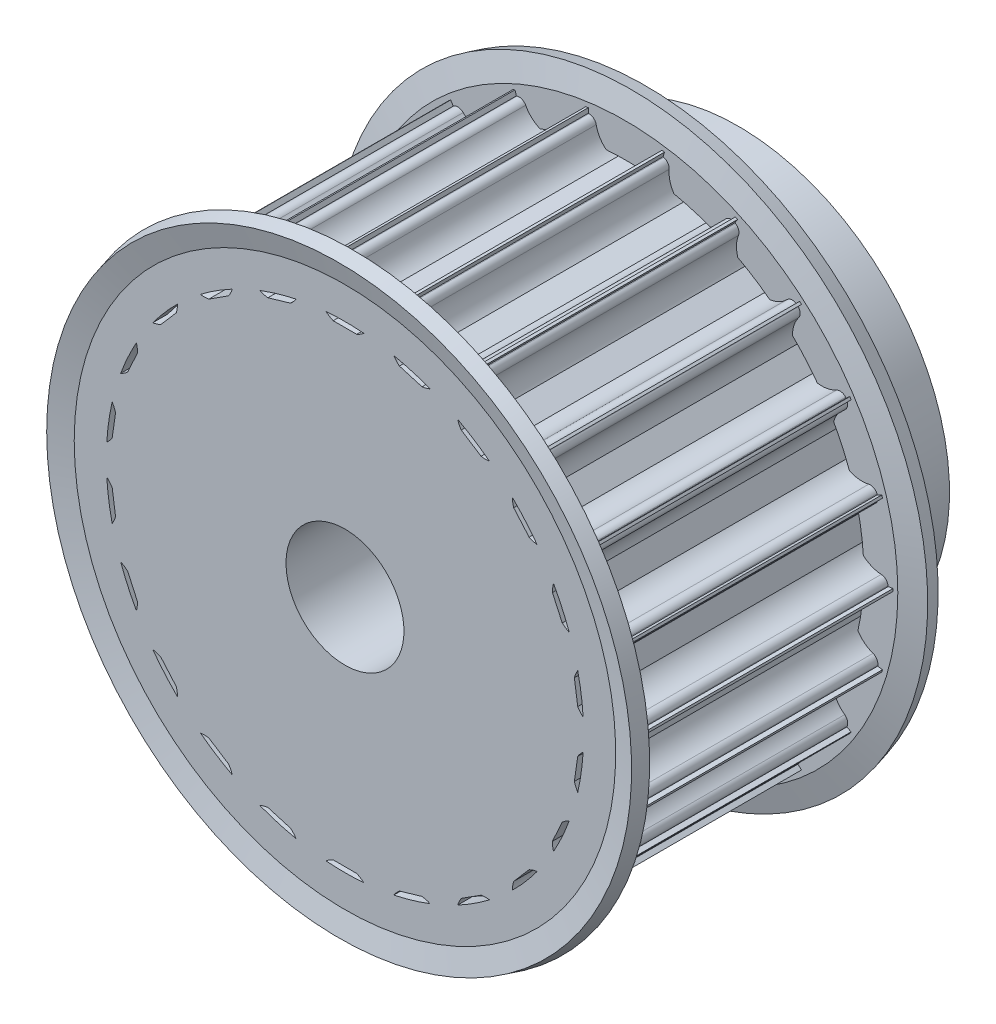
from build123d import *

# Parameters (mm, degrees)
CUT_EXTRUDE1_DEPTH = 56.543901555
CIRPATTERN1_COUNT  = 22


with BuildPart() as part:
    # Sketch2 → Revolve1 (revolve)
    with BuildSketch(Plane(origin=(0, 0, 0), x_dir=(0, 0, -1), z_dir=(1, 0, 0)), mode=Mode.PRIVATE) as revolve1_sk:
        Polygon((0, 6), (0, 27.25), (30, 27.25), (30, 21.5), (40, 21.5), (40, 6), align=None)
    revolve(revolve1_sk.sketch.rotate(Axis((0, 0, -88.99), (0, 0, 1)), 90), axis=Axis((0, 0, -88.99), (0, 0, 1)))

    # Sketch3 → Cut-Extrude1 (cut, symmetric)
    with BuildSketch(Plane.XY):
        with BuildLine():
            Line((3.674234614, 26.5), (3.75, 26.5))
            Line((3.75, 26.5), (3.75, 28.5))
            Line((3.75, 28.5), (-3.75, 28.5))
            Line((-3.75, 28.5), (-3.75, 26.5))
            Line((-3.75, 26.5), (-3.674234614, 26.5))
            ThreePointArc((-3.674234614, 26.5), (-3.199892965, 26.330947502), (-2.939387691, 25.9))
            ThreePointArc((-2.939387691, 25.9), (-2.331759211, 24.612435701), (-1.198957881, 23.75))
            Line((-1.198957881, 23.75), (1.198957881, 23.75))
            ThreePointArc((1.198957881, 23.75), (2.331759211, 24.612435701), (2.939387691, 25.9))
            ThreePointArc((2.939387691, 25.9), (3.199892965, 26.330947502), (3.674234614, 26.5))
        make_face()
    cut_extrude1 = extrude(amount=CUT_EXTRUDE1_DEPTH, both=True, mode=Mode.SUBTRACT)

    # CirPattern1: Cut-Extrude1 ×22 about axis
    cirpattern1_axis = Axis((0, 0, 0), (0, 0, 1))
    for i in range(1, CIRPATTERN1_COUNT):
        add(cut_extrude1.rotate(cirpattern1_axis, i * 360 / CIRPATTERN1_COUNT), mode=Mode.SUBTRACT)

    # Sketch4 → Revolve2 (revolve)
    with BuildSketch(Plane(origin=(0, 0, 0), x_dir=(0, 0, -1), z_dir=(1, 0, 0)), mode=Mode.PRIVATE) as revolve2_sk:
        Polygon((0, 24.279659825), (1.5, 24.279659825), (1.5, 27.740739153), (0.856921938, 30.140739153), (-0.591966801, 29.752510585), (0, 27.543260406), align=None)
        Polygon((30, 24.279659825), (28.5, 24.279659825), (28.5, 27.740739153), (29.143078062, 30.140739153), (30.591966801, 29.752510585), (30, 27.543260406), align=None)
    revolve(revolve2_sk.sketch.rotate(Axis((0, 0, -88.99), (0, 0, 1)), 90), axis=Axis((0, 0, -88.99), (0, 0, 1)))


solid = part.part
